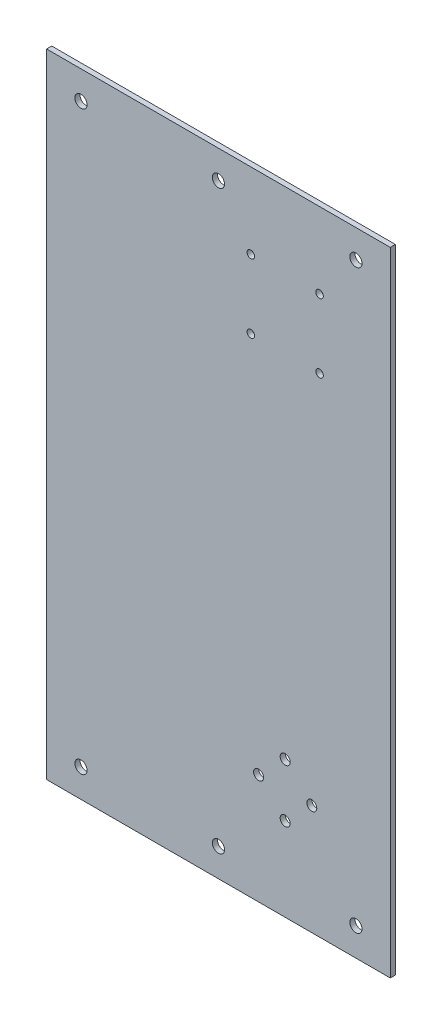
from build123d import *

# Parameters (mm, degrees)
SKETCH1_W            = 155
SKETCH1_H            = 285.39
BOSS_EXTRUDE1_DEPTH  = 2.305
M5_CLEARANCE_HOLE1_D = 5.5
SKETCH4_R            = 2.25
SKETCH4_R_2          = 1.7
CUT_EXTRUDE1_DEPTH   = 163.398971826


with BuildPart() as part:
    # Sketch1 → Boss-Extrude1 (new body)
    with BuildSketch(Plane.XY):
        Rectangle(SKETCH1_W, SKETCH1_H)
    extrude(amount=BOSS_EXTRUDE1_DEPTH)

    # M5 Clearance Hole1 (through all)
    with Locations(Plane.XY.offset(2.305)):
        with Locations((-62, 129.995), (0, 129.995), (-62, -129.995), (0, -129.995), (62, -129.995)):
            m5_clearance_hole1 = Hole(M5_CLEARANCE_HOLE1_D / 2)

    # Sketch4 → Cut-Extrude1 (cut, through all)
    with BuildSketch(Plane.XY.offset(2.305)):
        with Locations((30.1, -81)):
            Circle(SKETCH4_R)
        with Locations((42.1, -93)):
            Circle(SKETCH4_R)
        with Locations((30.1, -105)):
            Circle(SKETCH4_R)
        with Locations((18.1, -93)):
            Circle(SKETCH4_R)
        with Locations((45.6, 108.5)):
            Circle(SKETCH4_R_2)
        with Locations((14.6, 77.5)):
            Circle(SKETCH4_R_2)
        with Locations((45.6, 77.5)):
            Circle(SKETCH4_R_2)
        with Locations((14.6, 108.5)):
            Circle(SKETCH4_R_2)
    extrude(amount=-CUT_EXTRUDE1_DEPTH, mode=Mode.SUBTRACT)

    # Mirror1: M5 Clearance Hole1 across plane
    add(m5_clearance_hole1.mirror(Plane.ZX), mode=Mode.SUBTRACT)


solid = part.part
